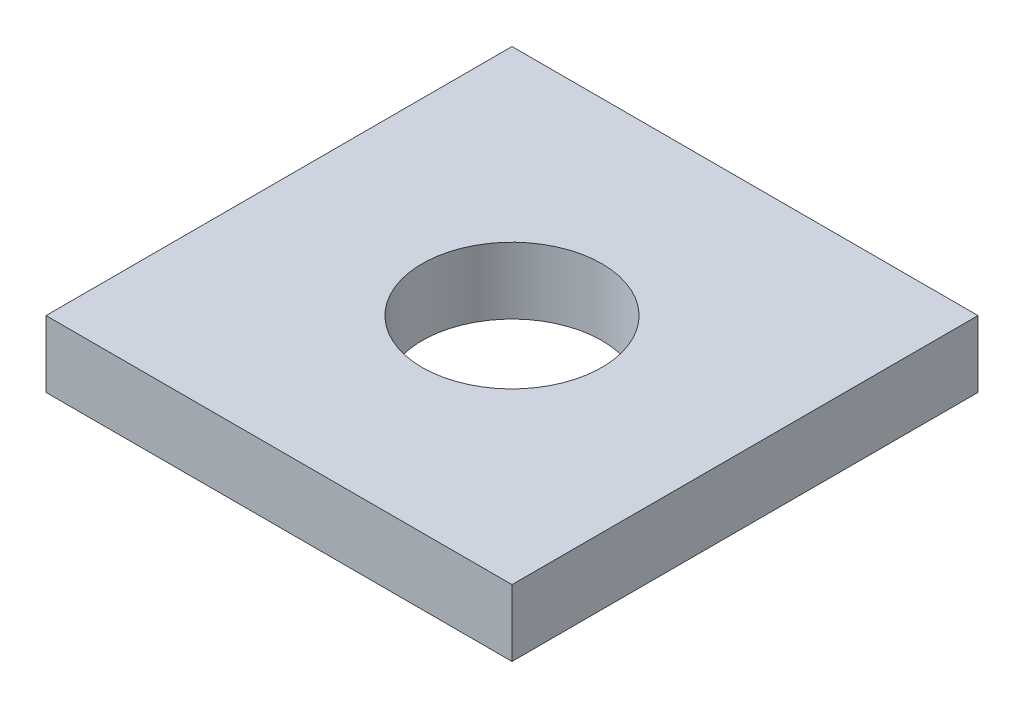
from build123d import *

# Parameters (mm, degrees)
SKETCH_1_W      = 7
SKETCH_1_H      = 7
SKETCH_1_R      = 1.35
EXTRUDE_1_DEPTH = 1


with BuildPart() as part:
    # 草图1 → 凸台-拉伸1 (new body)
    with BuildSketch(Plane(origin=(0, 0, 0), x_dir=(1, 0, 0), z_dir=(0, 1, 0))):
        Rectangle(SKETCH_1_W, SKETCH_1_H)
        with Locations(Location((0, 0, 0), (0, 0, 270))):
            Circle(SKETCH_1_R, mode=Mode.SUBTRACT)
    extrude(amount=EXTRUDE_1_DEPTH)


solid = part.part
